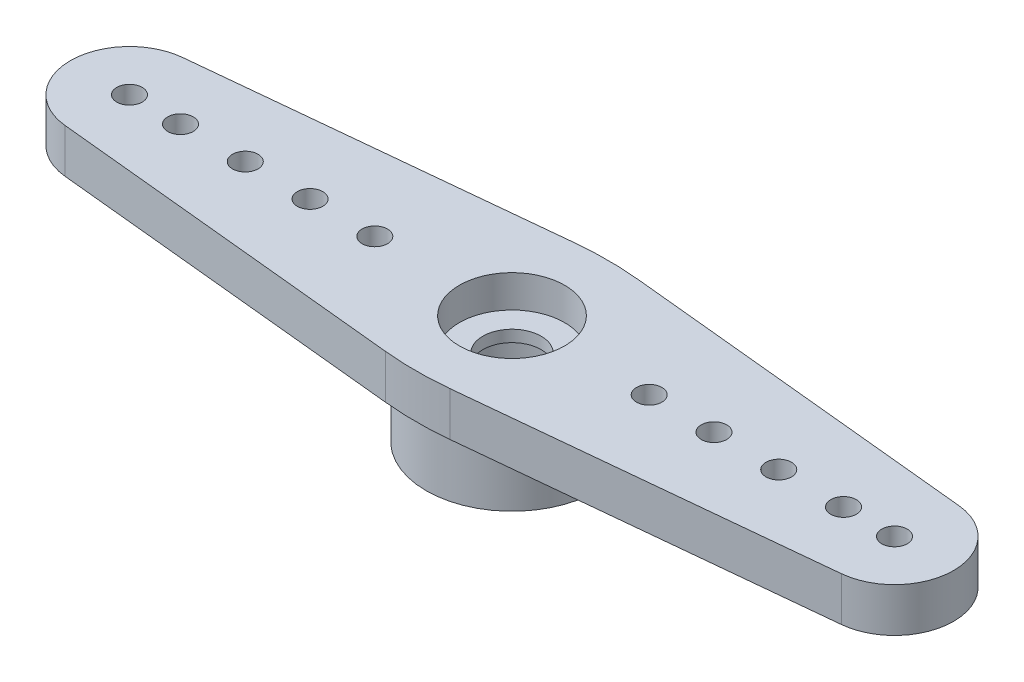
from build123d import *

# Parameters (mm, degrees)
SKETCH1_R           = 3.3655
SKETCH1_R_2         = 2.5
BOSS_EXTRUDE1_DEPTH = 2.54
SKETCH2_R           = 0.5
SKETCH2_R_2         = 1.143
BOSS_EXTRUDE2_DEPTH = 1.7272
FILLET1_R           = 12.7
CUT_EXTRUDE1_START  = -1.27
SKETCH3_R           = 2.06375
SKETCH3_R_2         = 1.143
CUT_EXTRUDE1_DEPTH  = 1.27


with BuildPart() as part:
    # Sketch1 → Boss-Extrude1 (new body)
    with BuildSketch(Plane(origin=(0, 0, 0), x_dir=(1, 0, 0), z_dir=(0, 1, 0))):
        with Locations(Location((0, 0, 0), (0, 0, 270))):
            Circle(SKETCH1_R)
        with Locations(Location((0, 0, 0), (0, 0, 270))):
            Circle(SKETCH1_R_2, mode=Mode.SUBTRACT)
    extrude(amount=BOSS_EXTRUDE1_DEPTH)

    # Sketch2 → Boss-Extrude2 (add)
    with BuildSketch(Plane(origin=(0, 2.54, 0), x_dir=(1, 0, 0), z_dir=(0, 1, 0))):
        with BuildLine():
            Line((0, 3.8227), (15.229633673, 2.30634634))
            ThreePointArc((15.229633673, 2.30634634), (17.31775, 0), (15.229633673, -2.30634634))
            Line((15.229633673, -2.30634634), (0, -3.8227))
            Line((0, -3.8227), (-15.229633673, -2.30634634))
            ThreePointArc((-15.229633673, -2.30634634), (-17.31775, 0), (-15.229633673, 2.30634634))
            Line((-15.229633673, 2.30634634), (0, 3.8227))
        make_face()
        with Locations(Location((-10.46, 0, 0), (0, 0, 270))):
            Circle(SKETCH2_R, mode=Mode.SUBTRACT)
        with Locations(Location((-7.92, 0, 0), (0, 0, 270))):
            Circle(SKETCH2_R, mode=Mode.SUBTRACT)
        with Locations(Location((-5.38, 0, 0), (0, 0, 270))):
            Circle(SKETCH2_R, mode=Mode.SUBTRACT)
        with Locations(Location((15, 0, 0), (0, 0, 270))):
            Circle(SKETCH2_R, mode=Mode.SUBTRACT)
        with Locations(Location((5.38, 0, 0), (0, 0, 270))):
            Circle(SKETCH2_R, mode=Mode.SUBTRACT)
        with Locations(Location((7.92, 0, 0), (0, 0, 270))):
            Circle(SKETCH2_R, mode=Mode.SUBTRACT)
        with Locations(Location((-13, 0, 0), (0, 0, 270))):
            Circle(SKETCH2_R, mode=Mode.SUBTRACT)
        with Locations(Location((-15, 0, 0), (0, 0, 270))):
            Circle(SKETCH2_R, mode=Mode.SUBTRACT)
        with Locations(Location((0, 0, 0), (0, 0, 270))):
            Circle(SKETCH2_R_2, mode=Mode.SUBTRACT)
        with Locations(Location((10.46, 0, 0), (0, 0, 270))):
            Circle(SKETCH2_R, mode=Mode.SUBTRACT)
        with Locations(Location((13, 0, 0), (0, 0, 270))):
            Circle(SKETCH2_R, mode=Mode.SUBTRACT)
    extrude(amount=BOSS_EXTRUDE2_DEPTH)

    # Fillet1
    fillet1_edges = [part.edges().sort_by_distance(p)[0] for p in [
        (0, 3.4036, 3.8227),
        (0, 3.4036, -3.8227),
    ]]
    fillet(fillet1_edges, radius=FILLET1_R)

    # Sketch3 → Cut-Extrude1 (cut)
    with BuildSketch(Plane(origin=(0, 4.2672, 0), x_dir=(1, 0, 0), z_dir=(0, 1, 0)).offset(CUT_EXTRUDE1_START)):
        with Locations(Location((0, 0, 0), (0, 0, 270))):
            Circle(SKETCH3_R)
        with Locations(Location((0, 0, 0), (0, 0, 270))):
            Circle(SKETCH3_R_2, mode=Mode.SUBTRACT)
    extrude(amount=CUT_EXTRUDE1_DEPTH, mode=Mode.SUBTRACT)


solid = part.part
